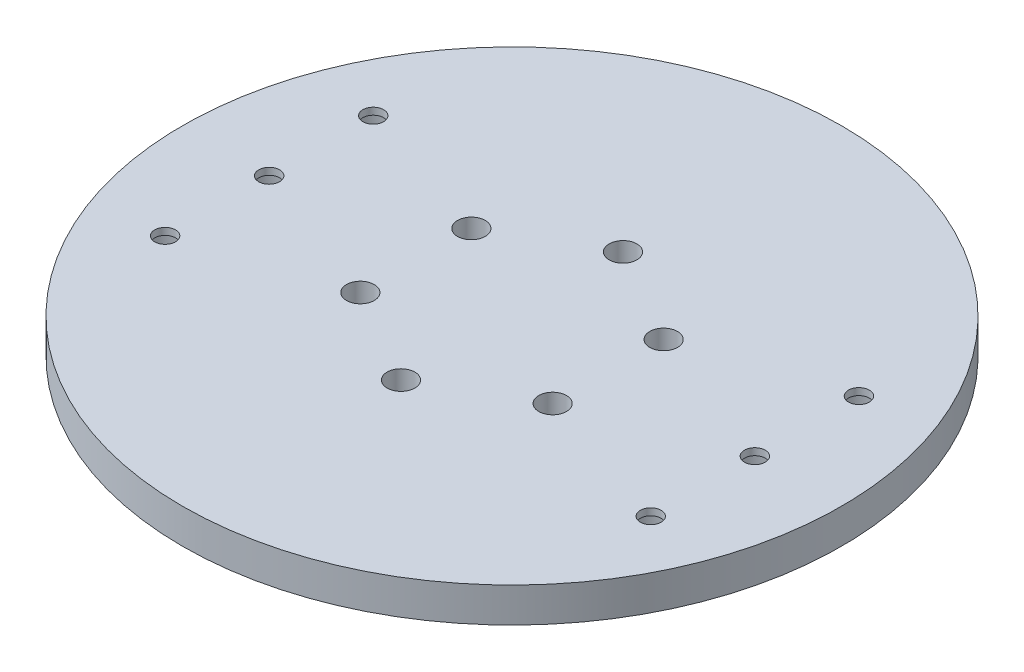
from build123d import *

# Parameters (mm, degrees)
CROQUIS1_R              = 24.5
SALIENTE_EXTRUIR1_DEPTH = 3.7
CROQUIS2_R              = 2
CORTAR_EXTRUIR1_DEPTH   = 35.845229229
MATRIZC1_COUNT          = 6
SALIENTE_EXTRUIR2_START = 5
CROQUIS3_R              = 47.5
CROQUIS3_R_2            = 2
SALIENTE_EXTRUIR2_DEPTH = 5
CROQUIS6_R              = 1.5
CORTAR_EXTRUIR2_DEPTH   = 68.736179402
CORTAR_EXTRUIR3_START   = -4
CROQUIS7_R              = 3.5
CROQUIS7_R_2            = 1.5
CORTAR_EXTRUIR3_DEPTH   = 4


with BuildPart() as part:
    # Croquis1 → Saliente-Extruir1 (new body)
    with BuildSketch(Plane(origin=(0, 0, 0), x_dir=(1, 0, 0), z_dir=(0, 1, 0))):
        with Locations(Location((0, 0, 0), (0, 0, 270))):
            Circle(CROQUIS1_R)
    extrude(amount=SALIENTE_EXTRUIR1_DEPTH)

    # Croquis2 → Cortar-Extruir1 (cut, through all)
    with BuildSketch(Plane(origin=(0, 3.7, 0), x_dir=(1, 0, 0), z_dir=(0, 1, 0))):
        with Locations(Location((0, 16, 0), (0, 0, 270))):
            Circle(CROQUIS2_R)
    cortar_extruir1 = extrude(amount=-CORTAR_EXTRUIR1_DEPTH, mode=Mode.SUBTRACT)

    # MatrizC1: Cortar-Extruir1 ×6 about axis
    matrizc1_axis = Axis((0, 0, 0), (0, 1, 0))
    for i in range(1, MATRIZC1_COUNT):
        add(cortar_extruir1.rotate(matrizc1_axis, i * 360 / MATRIZC1_COUNT), mode=Mode.SUBTRACT)

    # Croquis3 → Saliente-Extruir2 (add)
    with BuildSketch(Plane(origin=(0, 3.7, 0), x_dir=(1, 0, 0), z_dir=(0, 1, 0)).offset(SALIENTE_EXTRUIR2_START)):
        with Locations(Location((0, 0, 0), (0, 0, 270))):
            Circle(CROQUIS3_R)
        with Locations(Location((13.856406461, 8, 0), (0, 0, 270))):
            Circle(CROQUIS3_R_2, mode=Mode.SUBTRACT)
        with Locations(Location((13.856406461, -8, 0), (0, 0, 270))):
            Circle(CROQUIS3_R_2, mode=Mode.SUBTRACT)
        with Locations(Location((0, -16, 0), (0, 0, 270))):
            Circle(CROQUIS3_R_2, mode=Mode.SUBTRACT)
        with Locations(Location((-13.856406461, -8, 0), (0, 0, 270))):
            Circle(CROQUIS3_R_2, mode=Mode.SUBTRACT)
        with Locations(Location((-13.856406461, 8, 0), (0, 0, 270))):
            Circle(CROQUIS3_R_2, mode=Mode.SUBTRACT)
        with Locations(Location((0, 16, 0), (0, 0, 270))):
            Circle(CROQUIS3_R_2, mode=Mode.SUBTRACT)
    extrude(amount=-SALIENTE_EXTRUIR2_DEPTH)

    # Croquis6 → Cortar-Extruir2 (cut, through all)
    with BuildSketch(Plane(origin=(0, 8.7, 0), x_dir=(1, 0, 0), z_dir=(0, 1, 0))):
        with Locations(Location((-35, 15, 0), (0, 0, 270))):
            Circle(CROQUIS6_R)
        with Locations(Location((-35, 0, 0), (0, 0, 270))):
            Circle(CROQUIS6_R)
        with Locations(Location((-35, -15, 0), (0, 0, 270))):
            Circle(CROQUIS6_R)
    cortar_extruir2 = extrude(amount=-CORTAR_EXTRUIR2_DEPTH, mode=Mode.SUBTRACT)

    # Simetría1: Cortar-Extruir2 across plane
    add(cortar_extruir2.mirror(Plane(origin=(0, 0, 0), x_dir=(0, 0, 1), z_dir=(1, 0, 0))), mode=Mode.SUBTRACT)

    # Croquis7 → Cortar-Extruir3 (cut)
    # profile 1 of 6: a face of its own
    with BuildSketch(Plane.XZ.offset(-3.7).offset(CORTAR_EXTRUIR3_START)):
        with Locations(Location((35, 15, 0), (0, 0, 270))):
            Circle(CROQUIS7_R)
        with Locations(Location((35, 15, 0), (0, 0, 90))):
            Circle(CROQUIS7_R_2, mode=Mode.SUBTRACT)
    # profile 2 of 6: a face of its own
    with BuildSketch(Plane.XZ.offset(-3.7).offset(CORTAR_EXTRUIR3_START)):
        with Locations(Location((35, 0, 0), (0, 0, 270))):
            Circle(CROQUIS7_R)
        with Locations(Location((35, 0, 0), (0, 0, 90))):
            Circle(CROQUIS7_R_2, mode=Mode.SUBTRACT)
    # profile 3 of 6: a face of its own
    with BuildSketch(Plane.XZ.offset(-3.7).offset(CORTAR_EXTRUIR3_START)):
        with Locations(Location((35, -15, 0), (0, 0, 270))):
            Circle(CROQUIS7_R)
        with Locations(Location((35, -15, 0), (0, 0, 90))):
            Circle(CROQUIS7_R_2, mode=Mode.SUBTRACT)
    # profile 4 of 6: a face of its own
    with BuildSketch(Plane.XZ.offset(-3.7).offset(CORTAR_EXTRUIR3_START)):
        with Locations(Location((-35, 15, 0), (0, 0, 270))):
            Circle(CROQUIS7_R)
        with Locations(Location((-35, 15, 0), (0, 0, 90))):
            Circle(CROQUIS7_R_2, mode=Mode.SUBTRACT)
    # profile 5 of 6: a face of its own
    with BuildSketch(Plane.XZ.offset(-3.7).offset(CORTAR_EXTRUIR3_START)):
        with Locations(Location((-35, 0, 0), (0, 0, 270))):
            Circle(CROQUIS7_R)
        with Locations(Location((-35, 0, 0), (0, 0, 90))):
            Circle(CROQUIS7_R_2, mode=Mode.SUBTRACT)
    # profile 6 of 6: a face of its own
    with BuildSketch(Plane.XZ.offset(-3.7).offset(CORTAR_EXTRUIR3_START)):
        with Locations(Location((-35, -15, 0), (0, 0, 270))):
            Circle(CROQUIS7_R)
        with Locations(Location((-35, -15, 0), (0, 0, 90))):
            Circle(CROQUIS7_R_2, mode=Mode.SUBTRACT)
    extrude(amount=CORTAR_EXTRUIR3_DEPTH, mode=Mode.SUBTRACT)


solid = part.part
